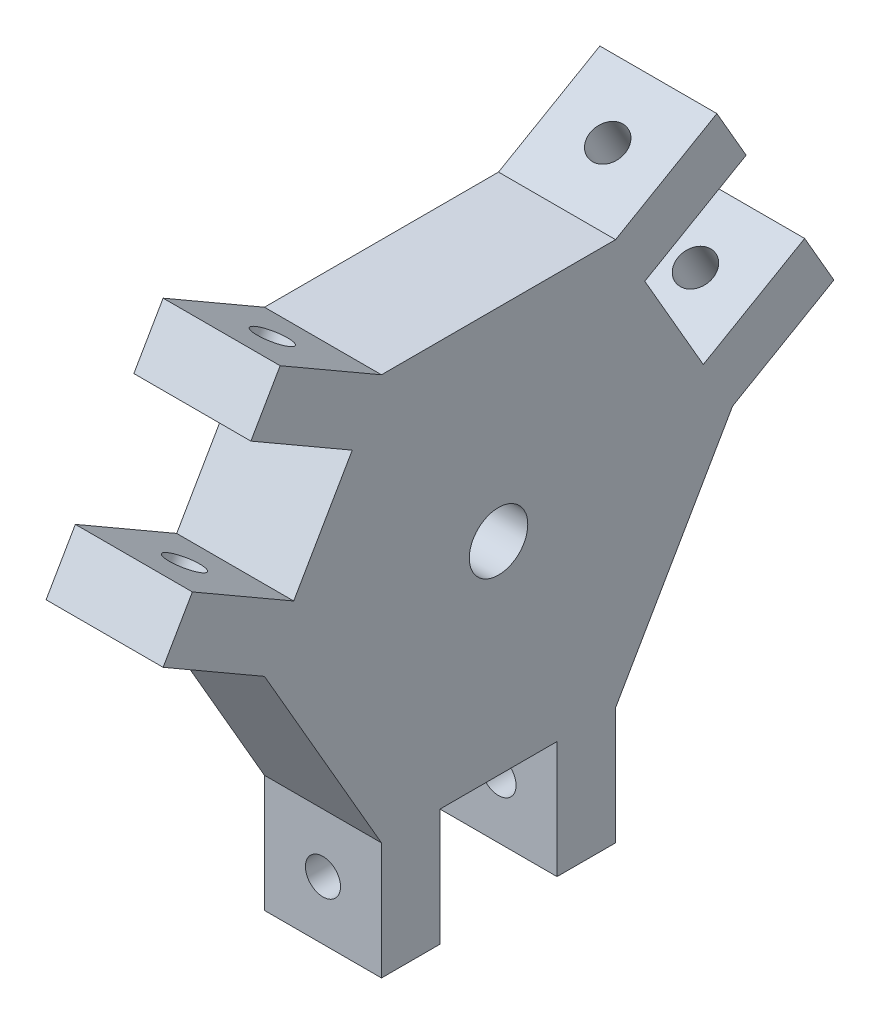
from build123d import *

# Parameters (mm, degrees)
EXTRUDE_1_DEPTH          = 20
SKETCH_2_W               = 20
SKETCH_2_H               = 10
EXTRUDE_2_DEPTH          = 20
SKETCH_3_W               = 20
SKETCH_3_H               = 10
EXTRUDE_3_DEPTH          = 20
SKETCH_4_R               = 3
CUT_EXTRUDE_1_DEPTH      = 88.361609461
CUT_EXTRUDE_2_DEPTH      = 76.355563624
CUT_EXTRUDE_2_DEPTH_BACK = 76.355563624
SKETCH_5_R               = 5
PATTERN_CIRCULAR_1_COUNT = 3


with BuildPart() as part:
    # 草图1 → 凸台-拉伸1 (new body)
    with BuildSketch(Plane(origin=(0, 0, 0), x_dir=(0, 0, -1), z_dir=(1, 0, 0))):
        Polygon((20, -34.641016151), (-20, -34.641016151), (-40, 0), (-20, 34.641016151), (20, 34.641016151), (40, 0), align=None)
    extrude(amount=EXTRUDE_1_DEPTH)

    # 草图2 → 凸台-拉伸2 (add)
    with BuildSketch(Plane(origin=(0, 17.320508076, 30), x_dir=(1, 0, 0), z_dir=(0, 0.500000000000003, 0.8660254037844369))):
        with Locations((10, 15)):
            Rectangle(SKETCH_2_W, SKETCH_2_H)
    extrude_2 = extrude(amount=EXTRUDE_2_DEPTH)

    # 草图3 → 凸台-拉伸3 (add)
    with BuildSketch(Plane(origin=(0, 17.320508076, 30), x_dir=(1, 0, 0), z_dir=(0, 0.500000000000003, 0.8660254037844369))):
        with Locations((10, -15)):
            Rectangle(SKETCH_3_W, SKETCH_3_H)
    extrude_3 = extrude(amount=EXTRUDE_3_DEPTH)

    # 草图4 → 切除-拉伸1 (cut, symmetric)
    with BuildSketch(Plane(origin=(0, 17.320508076, -10), x_dir=(1, 0, 0), z_dir=(0, 0.8660254037844369, -0.500000000000003))):
        with Locations(Location((10, -44.641016151, 0), (0, 0, 270))):
            Circle(SKETCH_4_R)
    cut_extrude_1 = extrude(amount=CUT_EXTRUDE_1_DEPTH, both=True, mode=Mode.SUBTRACT)

    # 草图5 → 切除-拉伸2 (cut, two sides: drawn at the far end of the back side and taken through both)
    with BuildSketch(Plane(origin=(20, 0, 0), x_dir=(0, 0, -1), z_dir=(1, 0, 0)).offset(-CUT_EXTRUDE_2_DEPTH_BACK)):
        Circle(SKETCH_5_R)
    extrude(amount=CUT_EXTRUDE_2_DEPTH + CUT_EXTRUDE_2_DEPTH_BACK, mode=Mode.SUBTRACT)

    # 阵列(圆周)1: 凸台-拉伸2, 凸台-拉伸3, 切除-拉伸1 ×3 about axis
    pattern_circular_1_axis = Axis((0, 0, 0), (1, 0, 0))
    add([extrude_2.rotate(pattern_circular_1_axis, i * 360 / PATTERN_CIRCULAR_1_COUNT) for i in range(1, PATTERN_CIRCULAR_1_COUNT)])
    add([extrude_3.rotate(pattern_circular_1_axis, i * 360 / PATTERN_CIRCULAR_1_COUNT) for i in range(1, PATTERN_CIRCULAR_1_COUNT)])
    add([cut_extrude_1.rotate(pattern_circular_1_axis, i * 360 / PATTERN_CIRCULAR_1_COUNT) for i in range(1, PATTERN_CIRCULAR_1_COUNT)], mode=Mode.SUBTRACT)


solid = part.part
